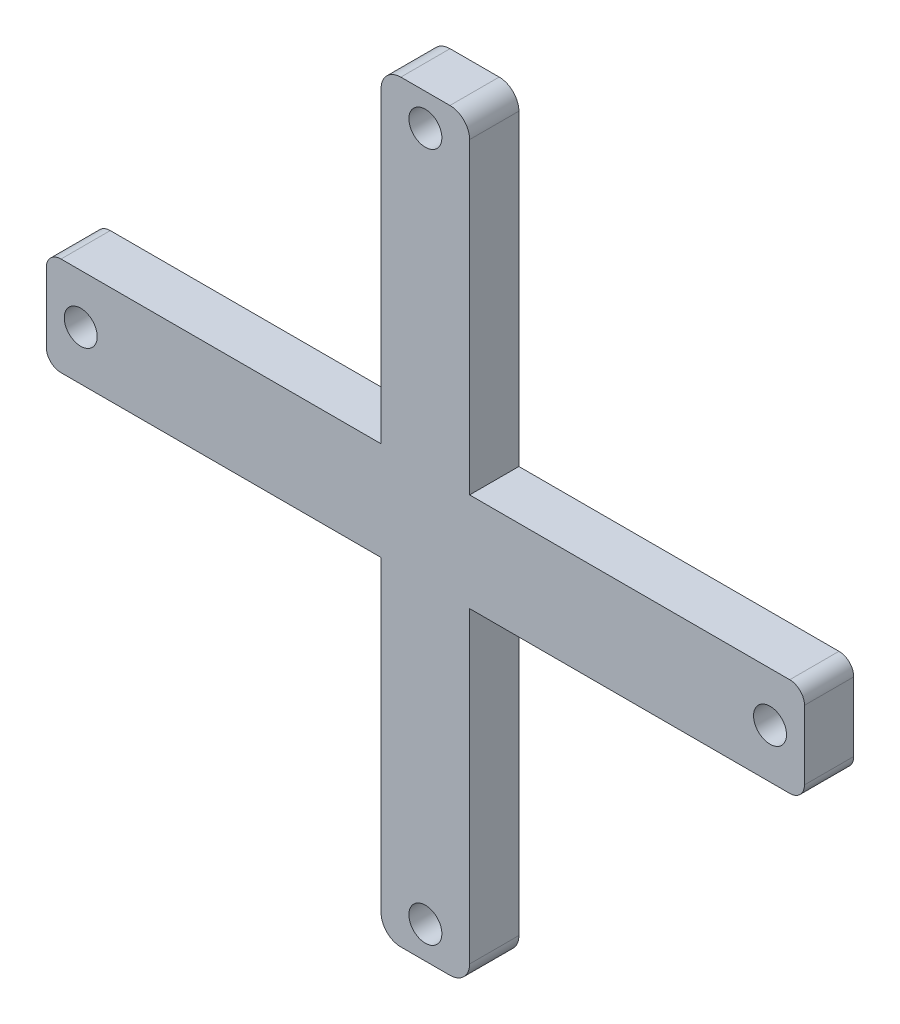
from build123d import *

# Parameters (mm, degrees)
SKETCH1_R           = 4.25
BOSS_EXTRUDE1_DEPTH = 12.7
SKETCH3_R           = 4.25
BOSS_EXTRUDE3_DEPTH = 12.7
SKETCH2_R           = 4.25
BOSS_EXTRUDE2_DEPTH = 6.35


with BuildPart() as part:
    # Sketch1 → Boss-Extrude1 (new body)
    with BuildSketch(Plane.XY):
        with BuildLine():
            Line((93.98, -12.7), (-93.98, -12.7))
            ThreePointArc((-93.98, -12.7), (-96.674076836, -11.584076836), (-97.79, -8.89))
            Line((-97.79, -8.89), (-97.79, 8.89))
            ThreePointArc((-97.79, 8.89), (-96.674076836, 11.584076836), (-93.98, 12.7))
            Line((-93.98, 12.7), (93.98, 12.7))
            ThreePointArc((93.98, 12.7), (96.674076836, 11.584076836), (97.79, 8.89))
            Line((97.79, 8.89), (97.79, -8.89))
            ThreePointArc((97.79, -8.89), (96.674076836, -11.584076836), (93.98, -12.7))
        make_face()
        with Locations((-88.9, 0)):
            Circle(SKETCH1_R, mode=Mode.SUBTRACT)
        with Locations((88.9, 0)):
            Circle(SKETCH1_R, mode=Mode.SUBTRACT)
    extrude(amount=BOSS_EXTRUDE1_DEPTH)

    # Sketch3 → Boss-Extrude3 (add, through all)
    with BuildSketch(Plane.XY.offset(12.7)):
        with BuildLine():
            Line((-6.335384206, -97.155), (6.335384206, -97.155))
            ThreePointArc((6.335384206, -97.155), (9.927486654, -95.667102448), (11.415384206, -92.075))
            Line((11.415384206, -92.075), (11.415384206, 92.075))
            ThreePointArc((11.415384206, 92.075), (9.927486654, 95.667102448), (6.335384206, 97.155))
            Line((6.335384206, 97.155), (-6.335384206, 97.155))
            ThreePointArc((-6.335384206, 97.155), (-9.927486654, 95.667102448), (-11.415384206, 92.075))
            Line((-11.415384206, 92.075), (-11.415384206, -92.075))
            ThreePointArc((-11.415384206, -92.075), (-9.927486654, -95.667102448), (-6.335384206, -97.155))
        make_face()
        with Locations((0, 88.9)):
            Circle(SKETCH3_R, mode=Mode.SUBTRACT)
        with Locations((0, -88.9)):
            Circle(SKETCH3_R, mode=Mode.SUBTRACT)
    extrude(amount=-BOSS_EXTRUDE3_DEPTH)

    # Sketch2 → Boss-Extrude2 (add)
    with BuildSketch(Plane(origin=(0, 0, 0), x_dir=(-1, 0, 0), z_dir=(0, 0, -1))):
        with Locations(Location((0, 88.9, 0), (0, 0, 180))):
            Circle(SKETCH2_R)
        with Locations((-88.9, 0)):
            Circle(SKETCH2_R)
        with Locations(Location((0, -88.9, 0), (0, 0, 180))):
            Circle(SKETCH2_R)
        with Locations((88.9, 0)):
            Circle(SKETCH2_R)
    extrude(amount=-BOSS_EXTRUDE2_DEPTH)


solid = part.part
